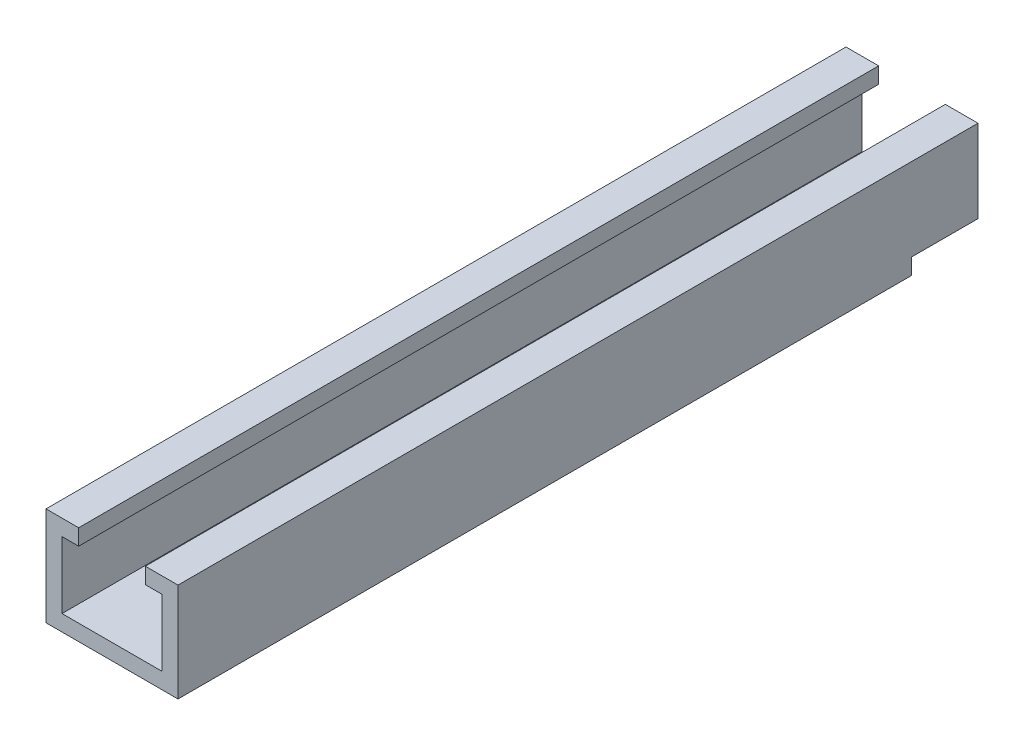
from build123d import *

# Parameters (mm, degrees)
SKETCH1_W                         = 99
SKETCH1_H                         = 12
BASEPLATE_DEPTH                   = 600
SKETCH2_W                         = 12
SKETCH2_H                         = 600
SIDE_RAIL_DEPTH                   = 50
SKETCH3_W                         = 24.5
SKETCH3_H                         = 600
KEEPER_RAIL_DEPTH                 = 12
SKETCH5_W                         = 99
SKETCH5_H                         = 50
LAP_JOINT_CUTOUT_DEPTH            = 12
LAP_JOINT_BOLT_HOLE_PATTERN_D     = 4.2
LAP_JOINT_BOLT_HOLE_PATTERN_DEPTH = 14
LAP_JOINT_BOLT_HOLE_PATTERN_TIP   = 1.2618073


with BuildPart() as part:
    # Sketch1 → baseplate (new body)
    with BuildSketch(Plane.XY):
        with Locations((49.5, 6)):
            Rectangle(SKETCH1_W, SKETCH1_H)
    extrude(amount=BASEPLATE_DEPTH)

    # Sketch2 → side_rail (add)
    with BuildSketch(Plane(origin=(0, 12, 0), x_dir=(1, 0, 0), z_dir=(0, 1, 0))):
        with Locations((6, -300)):
            Rectangle(SKETCH2_W, SKETCH2_H)
    side_rail = extrude(amount=SIDE_RAIL_DEPTH)

    # Sketch3 → keeper rail (add)
    with BuildSketch(Plane(origin=(0, 62, 0), x_dir=(1, 0, 0), z_dir=(0, 1, 0))):
        with Locations((12.25, -300)):
            Rectangle(SKETCH3_W, SKETCH3_H)
    keeper_rail = extrude(amount=KEEPER_RAIL_DEPTH)

    # mirror rails: side_rail, keeper rail across plane
    add(side_rail.mirror(Plane.ZY.offset(-49.5)))
    add(keeper_rail.mirror(Plane.ZY.offset(-49.5)))

    # Sketch5 → lap joint cutout (cut)
    with BuildSketch(Plane.XZ):
        with Locations((49.5, 25)):
            Rectangle(SKETCH5_W, SKETCH5_H)
    extrude(amount=-LAP_JOINT_CUTOUT_DEPTH, mode=Mode.SUBTRACT)

    # lap joint bolt hole pattern
    with Locations(Plane(origin=(0, 12, 0), x_dir=(-1, 0, 0), z_dir=(0, -1, 0))):
        with Locations((-93, -10), (-6, -40), (-93, -40), (-6, -10)):
            Hole(LAP_JOINT_BOLT_HOLE_PATTERN_D / 2, depth=LAP_JOINT_BOLT_HOLE_PATTERN_DEPTH)
            with Locations((0, 0, -(LAP_JOINT_BOLT_HOLE_PATTERN_DEPTH + LAP_JOINT_BOLT_HOLE_PATTERN_TIP / 2))):  # 118° drill point
                Cone(0, LAP_JOINT_BOLT_HOLE_PATTERN_D / 2, LAP_JOINT_BOLT_HOLE_PATTERN_TIP, mode=Mode.SUBTRACT)


solid = part.part
